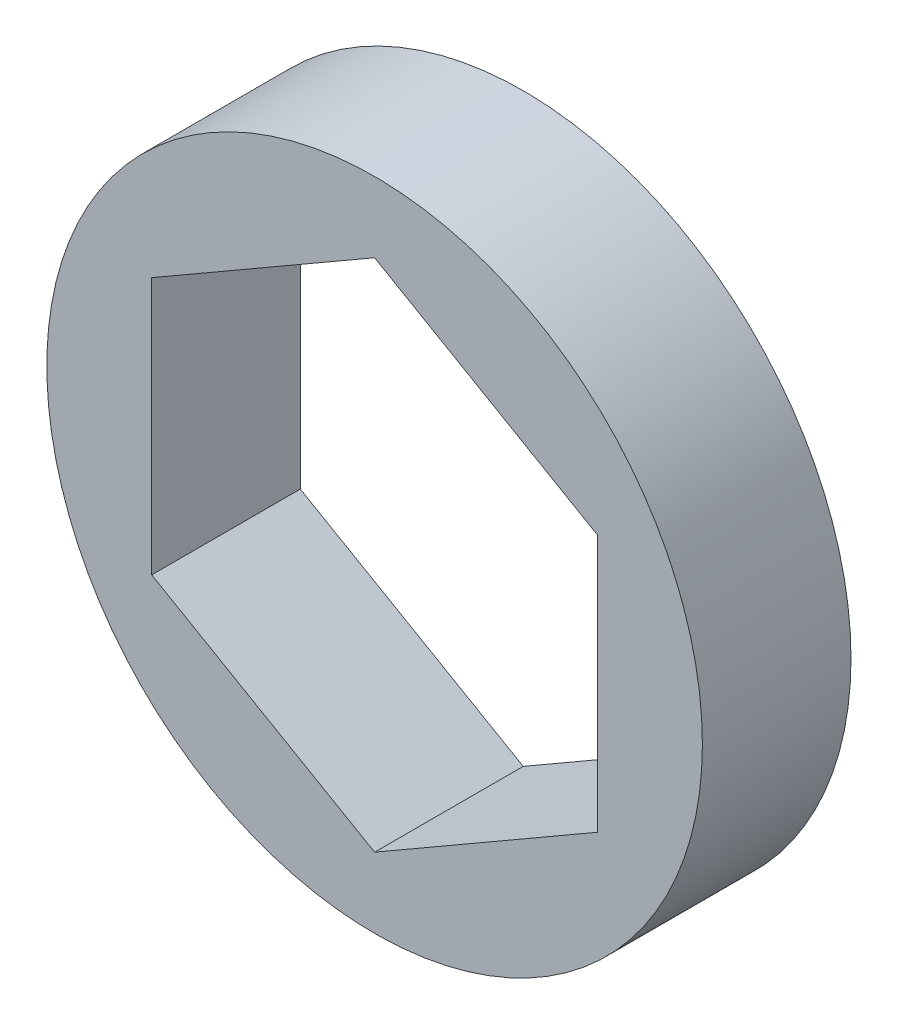
from build123d import *

# Parameters (mm, degrees)
SKETCH1_R           = 9.525
BOSS_EXTRUDE1_DEPTH = 4.318


with BuildPart() as part:
    # Sketch1 → Boss-Extrude1 (new body)
    with BuildSketch(Plane.XY):
        Circle(SKETCH1_R)
        Polygon((0, 7.478995387), (-6.477, 3.739497694), (-6.477, -3.739497694), (0, -7.478995387), (6.477, -3.739497694), (6.477, 3.739497694), align=None, mode=Mode.SUBTRACT)
    extrude(amount=BOSS_EXTRUDE1_DEPTH)


solid = part.part
